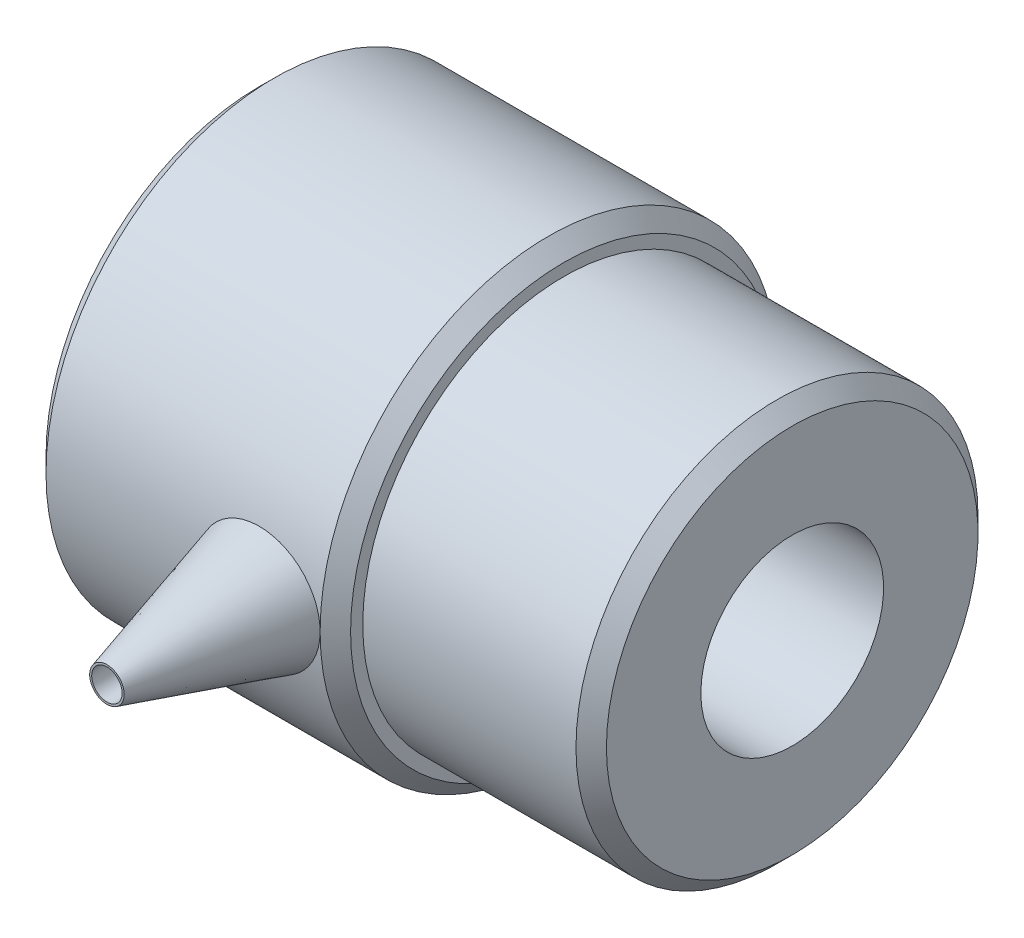
from build123d import *

# Parameters (mm, degrees)
CHAMFER1_SIZE  = 0.5
CHAMFER2_SIZE  = 0.5
CHAMFER3_SIZE  = 1
SKETCH2_R      = 2.5
EXTRUDE1_DEPTH = 10
SKETCH3_R      = 4
EXTRUDE2_DEPTH = 10
EXTRUDE2_TAPER = 16
SKETCH4_R      = 1
EXTRUDE3_DEPTH = 20


with BuildPart() as part:
    # Sketch1 → Revolve1 (revolve)
    with BuildSketch(Plane.XY, mode=Mode.PRIVATE) as revolve1_sk:
        Polygon((0, 6), (0, 13.2), (-15, 13.2), (-15, 15), (-35, 15), (-35, 11), (-33, 11), (-33, 10), (-17.11967558, 10), (-17.11967558, 11), (-15.11967558, 11), (-15.11967558, 6), align=None)
    revolve(revolve1_sk.sketch.rotate(Axis((-35, 0, 0), (1, 0, 0)), 90), axis=Axis((-35, 0, 0), (1, 0, 0)))

    # Chamfer1
    chamfer1_edges = [part.edges().sort_by_distance(p)[0] for p in [
        (-33, 0, -10),
    ]]
    chamfer(chamfer1_edges, length=CHAMFER1_SIZE)

    # Chamfer2
    chamfer2_edges = [part.edges().sort_by_distance(p)[0] for p in [
        (-15.11967558, 0, -6),
    ]]
    chamfer(chamfer2_edges, length=CHAMFER2_SIZE)

    # Chamfer3
    chamfer3_edges = [part.edges().sort_by_distance(p)[0] for p in [
        (0, 0, -13.2),
        (-15, 0, -15),
        (-35, 0, -15),
    ]]
    chamfer(chamfer3_edges, length=CHAMFER3_SIZE)

    # Sketch2 → Extrude1 (cut)
    with BuildSketch(Plane.XY.offset(15)):
        with Locations((-20, 0)):
            Circle(SKETCH2_R)
    extrude(amount=-EXTRUDE1_DEPTH, mode=Mode.SUBTRACT)


with BuildPart() as body_2:
    # Sketch3 → Extrude2 (new body)
    with BuildSketch(Plane.XY.offset(15)):
        with Locations((-20, 0)):
            Circle(SKETCH3_R)
    extrude(amount=EXTRUDE2_DEPTH, taper=EXTRUDE2_TAPER)

    # Sketch4 → Extrude3 (cut)
    with BuildSketch(Plane.XY.offset(15)):
        with Locations((-20, 0)):
            Circle(SKETCH4_R)
    extrude(amount=EXTRUDE3_DEPTH, mode=Mode.SUBTRACT)


solid = Compound([part.part, body_2.part])
